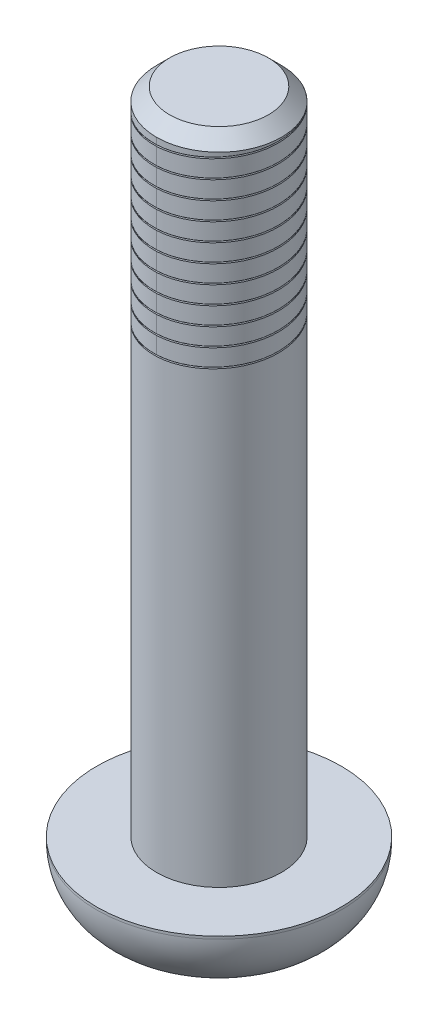
from build123d import *

# Parameters (mm, degrees)
SKETCH1_R              = 4.7
BOSS_EXTRUDE1_DEPTH    = 27.6
SKETCH2_OUTSIDE_W      = 17.526
SKETCH2_OUTSIDE_H      = 17.526
SKETCH2_OUTSIDE_R      = 2.4
CUT_EXTRUDE1_DEPTH     = 25
CHAMFER1_SIZE          = 0.5
CUT_EXTRUDE2_DEPTH     = 1.5
CUT_SWEEP1_PITCH       = 0.7
CUT_SWEEP1_HEIGHT      = 8
CUT_SWEEP1_RADIUS      = 2.5
CUT_SWEEP1_START_ANGLE = 180
FILLET1_R              = 2.5


with BuildPart() as part:
    # Sketch1 → Boss-Extrude1 (new body)
    with BuildSketch(Plane(origin=(0, 0, 0), x_dir=(1, 0, 0), z_dir=(0, 1, 0))):
        with Locations(Location((0, 0, 0), (0, 0, 90))):
            Circle(SKETCH1_R)
    extrude(amount=BOSS_EXTRUDE1_DEPTH)

    # Sketch2 outside → Cut-Extrude1 (cut)
    with BuildSketch(Plane(origin=(0, 27.6, 0), x_dir=(1, 0, 0), z_dir=(0, 1, 0))):
        Rectangle(SKETCH2_OUTSIDE_W, SKETCH2_OUTSIDE_H)
        with Locations(Location((0, 0, 0), (0, 0, 270))):
            Circle(SKETCH2_OUTSIDE_R, mode=Mode.SUBTRACT)
    extrude(amount=-CUT_EXTRUDE1_DEPTH, mode=Mode.SUBTRACT)

    # Chamfer1
    chamfer1_edges = [part.edges().sort_by_distance(p)[0] for p in [
        (0, 27.6, -2.4),
    ]]
    chamfer(chamfer1_edges, length=CHAMFER1_SIZE)

    # Sketch8 → Cut-Extrude2 (cut)
    with BuildSketch(Plane.XZ):
        Polygon((1.674315781, 0), (0.83715789, 1.45), (-0.83715789, 1.45), (-1.674315781, 0), (-0.83715789, -1.45), (0.83715789, -1.45), align=None)
    extrude(amount=-CUT_EXTRUDE2_DEPTH, mode=Mode.SUBTRACT)

    # Cut-Sweep1: sweep along a helix
    with BuildLine() as cut_sweep1_path:
        add(Helix(CUT_SWEEP1_PITCH, CUT_SWEEP1_HEIGHT, CUT_SWEEP1_RADIUS, center=(0, 27.6, 0), direction=(0, -1, 0), mode=Mode.PRIVATE).rotate(Axis((0, 27.6, 0), (0, -1, 0)), CUT_SWEEP1_START_ANGLE))
    # Sketch7 → Cut-Sweep1 (sweep, cut)
    with BuildSketch(Plane(origin=(0, 27.6, 2.5), x_dir=(0, 0, 1), z_dir=(-0.9990085288744749, -0.04451920075717363, 0))):
        with BuildLine():
            Line((-0.081023547, -0.030253267), (0.549038106, 0.274742329))
            Line((0.549038106, 0.274742329), (0.549038106, -0.425257671))
            Line((0.549038106, -0.425257671), (-0.081023547, -0.120262075))
            ThreePointArc((-0.081023547, -0.120262075), (-0.109238147, -0.075257671), (-0.081023547, -0.030253267))
        make_face()
    sweep(path=cut_sweep1_path.line, is_frenet=True, mode=Mode.SUBTRACT)

    # Fillet1
    fillet1_edges = [part.edges().sort_by_distance(p)[0] for p in [
        (0, 0, 4.7),
    ]]
    fillet(fillet1_edges, radius=FILLET1_R)


solid = part.part
